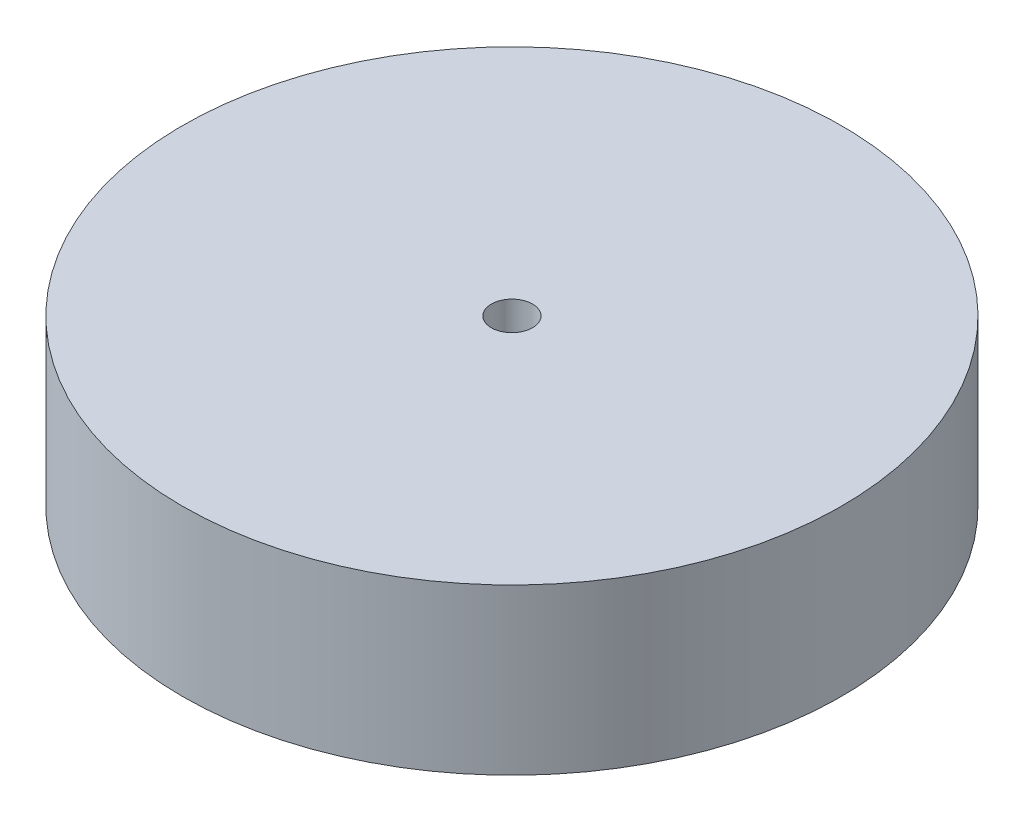
from build123d import *

# Parameters (mm, degrees)
SKETCH1_R           = 63.5
SKETCH1_R_2         = 3.96875
BOSS_EXTRUDE1_DEPTH = 31.75


with BuildPart() as part:
    # Sketch1 → Boss-Extrude1 (new body)
    with BuildSketch(Plane(origin=(0, 0, 0), x_dir=(1, 0, 0), z_dir=(0, 1, 0))):
        with Locations(Location((0, 0, 0), (0, 0, 270))):
            Circle(SKETCH1_R)
        with Locations(Location((0, 0, 0), (0, 0, 270))):
            Circle(SKETCH1_R_2, mode=Mode.SUBTRACT)
    extrude(amount=BOSS_EXTRUDE1_DEPTH)


solid = part.part
